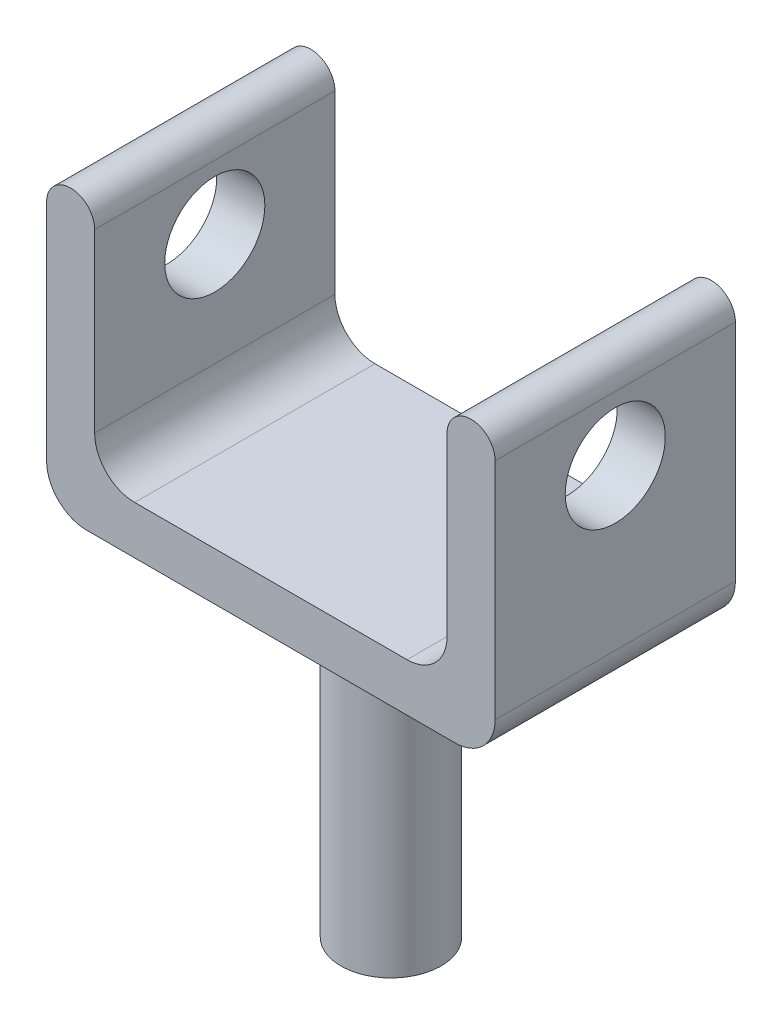
from build123d import *

# Parameters (mm, degrees)
BOSS_EXTRUDE1_DEPTH = 30
SKETCH3_R           = 6.25
BOSS_EXTRUDE2_DEPTH = 40
FILLET1_R           = 5
FILLET2_R           = 5
SKETCH4_R           = 6.25
CUT_EXTRUDE2_DEPTH  = 60


with BuildPart() as part:
    # Sketch2 → Boss-Extrude1 (new body)
    with BuildSketch(Plane.XY):
        with BuildLine():
            Line((-31.831168831, 30), (-31.831168831, -3))
            Line((-31.831168831, -3), (24.168831169, -3))
            Line((24.168831169, -3), (24.168831169, 30))
            ThreePointArc((24.168831169, 30), (21.168831169, 33), (18.168831169, 30))
            Line((18.168831169, 30), (18.168831169, 3))
            Line((18.168831169, 3), (-25.831168831, 3))
            Line((-25.831168831, 3), (-25.831168831, 30))
            ThreePointArc((-25.831168831, 30), (-28.831168831, 33), (-31.831168831, 30))
        make_face()
    extrude(amount=BOSS_EXTRUDE1_DEPTH)

    # Sketch3 → Boss-Extrude2 (add)
    with BuildSketch(Plane.XZ.offset(3)):
        with Locations(Location((-3.831168831, 15, 0), (0, 0, 270))):
            Circle(SKETCH3_R)
    extrude(amount=BOSS_EXTRUDE2_DEPTH)

    # Fillet1
    fillet1_edges = [part.edges().sort_by_distance(p)[0] for p in [
        (-31.831168831, -3, 15),
    ]]
    fillet(fillet1_edges, radius=FILLET1_R)

    # Fillet2
    fillet2_edges = [part.edges().sort_by_distance(p)[0] for p in [
        (24.168831169, -3, 15),
        (-25.831168831, 3, 15),
        (18.168831169, 3, 15),
    ]]
    fillet(fillet2_edges, radius=FILLET2_R)

    # Sketch4 → Cut-Extrude2 (cut)
    with BuildSketch(Plane.ZY.offset(31.831168831)):
        with Locations((15, 22)):
            Circle(SKETCH4_R)
    extrude(amount=-CUT_EXTRUDE2_DEPTH, mode=Mode.SUBTRACT)


solid = part.part
